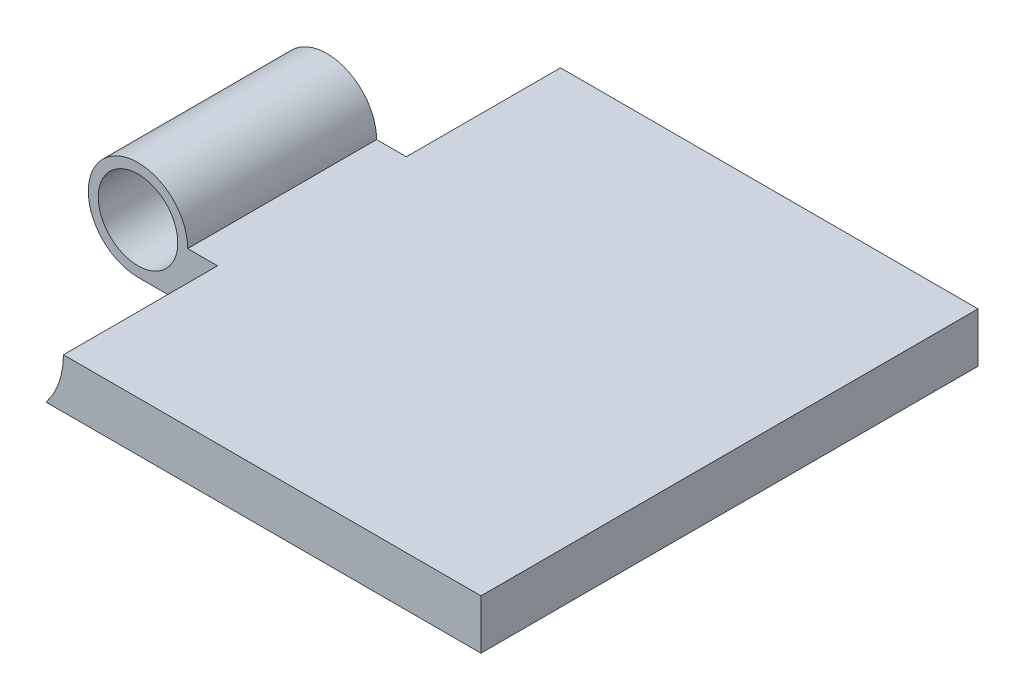
from build123d import *

# Parameters (mm, degrees)
SKETCH1_W           = 50
SKETCH1_H           = 5
BOSS_EXTRUDE1_DEPTH = 50
SKETCH2_R           = 8
CUT_EXTRUDE1_DEPTH  = 50
SKETCH3_R           = 5
SKETCH3_R_2         = 4
BOSS_EXTRUDE2_DEPTH = 19
BOSS_EXTRUDE4_DEPTH = 19


with BuildPart() as part:
    # Sketch1 → Boss-Extrude1 (new body)
    with BuildSketch(Plane.XY):
        with Locations((25, -2.5)):
            Rectangle(SKETCH1_W, SKETCH1_H)
    extrude(amount=-BOSS_EXTRUDE1_DEPTH)

    # Sketch2 → Cut-Extrude1 (cut)
    with BuildSketch(Plane.XY):
        Circle(SKETCH2_R)
    extrude(amount=-CUT_EXTRUDE1_DEPTH, mode=Mode.SUBTRACT)



with BuildPart() as body_2:
    # Sketch3 → Boss-Extrude2 (new body)
    with BuildSketch(Plane(origin=(0, 0, -15.5), x_dir=(-1, 0, 0), z_dir=(0, 0, -1))):
        Circle(SKETCH3_R)
        Circle(SKETCH3_R_2, mode=Mode.SUBTRACT)
    extrude(amount=BOSS_EXTRUDE2_DEPTH)


with BuildPart() as part_1:
    add(part.part)

    add(body_2.part)  # Boss-Extrude4 merges body 2
    # Sketch8 → Boss-Extrude4 (add)
    with BuildSketch(Plane(origin=(0, 0, -34.5), x_dir=(-1, 0, 0), z_dir=(0, 0, -1))):
        with BuildLine():
            Line((-4, 0), (-10, 0))
            Line((-10, 0), (-10, -5))
            Line((-10, -5), (0, -5))
            Line((0, -5), (0, -4))
            ThreePointArc((0, -4), (-2.828427125, -2.828427125), (-4, 0))
        make_face()
    extrude(amount=-BOSS_EXTRUDE4_DEPTH)


solid = part_1.part
